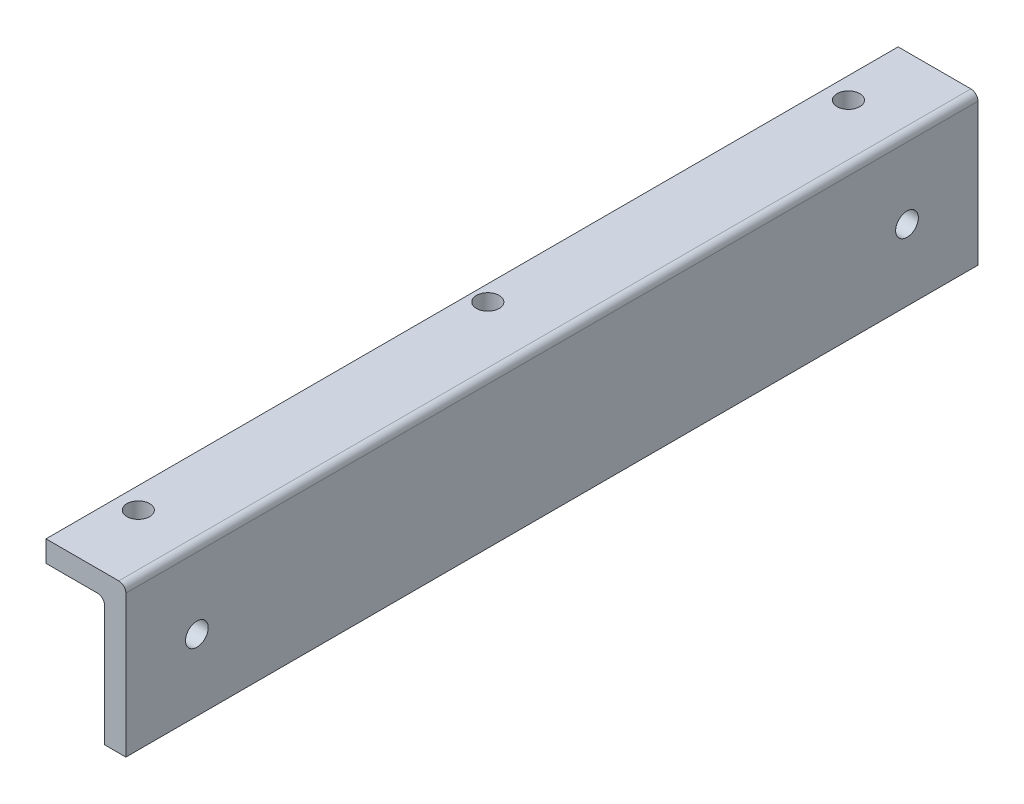
from build123d import *

# Parameters (mm, degrees)
EXTRUDE_1_DEPTH     = 60
FILLET_2_R          = 1
FILLET_3_R          = 1
SKETCH_6_R          = 1.6
CUT_EXTRUDE_3_DEPTH = 10
SKETCH_7_R          = 1.6
SKETCH_7_R_2        = 3.879374182
CUT_EXTRUDE_4_DEPTH = 10


with BuildPart() as part:
    # 草图1 → 凸台-拉伸1 (new, symmetric)
    with BuildSketch(Plane.XY):
        Polygon((-13.744850262, -0.762431654), (-13.744850262, 20.237568346), (-24.994850262, 20.237568346), (-24.994850262, 17.237568346), (-16.744850262, 17.237568346), (-16.744850262, -0.762431654), align=None)
    extrude(amount=EXTRUDE_1_DEPTH, both=True)

    # 圆角2
    fillet_2_edges = [part.edges().sort_by_distance(p)[0] for p in [
        (-13.744850262, 20.237568346, 0),
    ]]
    fillet(fillet_2_edges, radius=FILLET_2_R)

    # 圆角3
    fillet_3_edges = [part.edges().sort_by_distance(p)[0] for p in [
        (-16.744850262, 17.237568346, 0),
    ]]
    fillet(fillet_3_edges, radius=FILLET_3_R)

    # 草图6 → 切除-拉伸3 (cut)
    with BuildSketch(Plane.ZY.offset(16.744850262)):
        with Locations(Location((50, 9.237568346, 0), (0, 0, 270))):
            Circle(SKETCH_6_R)
        with Locations(Location((-50, 9.237568346, 0), (0, 0, 270))):
            Circle(SKETCH_6_R)
    extrude(amount=-CUT_EXTRUDE_3_DEPTH, mode=Mode.SUBTRACT)

    # 草图7 → 切除-拉伸4 (cut)
    with BuildSketch(Plane.XZ.offset(-17.237568346)):
        with Locations(Location((-21.994850262, -50, 0), (0, 0, 270))):
            Circle(SKETCH_7_R)
        with Locations(Location((-21.994850262, 50, 0), (0, 0, 270))):
            Circle(SKETCH_7_R)
        with Locations(Location((-22.777733305, 0, 0), (0, 0, 270))):
            Circle(SKETCH_7_R)
        with Locations((-6.137965093, 23.424487804)):
            Circle(SKETCH_7_R_2)
    extrude(amount=-CUT_EXTRUDE_4_DEPTH, mode=Mode.SUBTRACT)


solid = part.part
